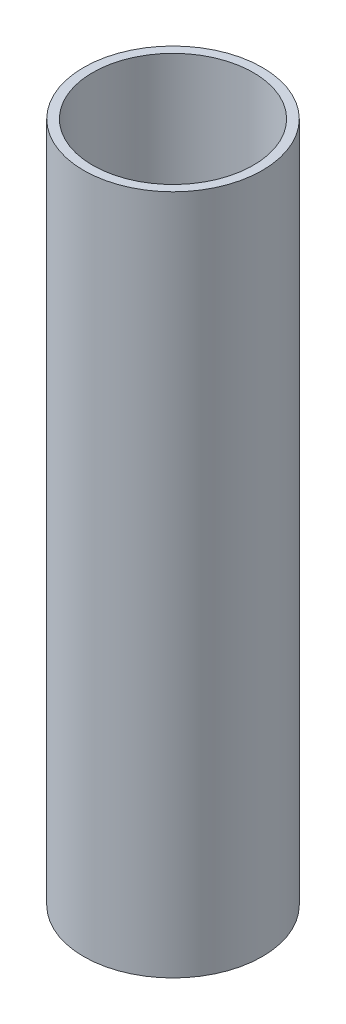
from build123d import *

# Parameters (mm, degrees)
SKETCH1_R           = 20
SKETCH1_R_2         = 18
BOSS_EXTRUDE1_DEPTH = 152.5


with BuildPart() as part:
    # Sketch1 → Boss-Extrude1 (new body)
    with BuildSketch(Plane(origin=(0, 0, 0), x_dir=(1, 0, 0), z_dir=(0, 1, 0))):
        with Locations(Location((0, 0, 0), (0, 0, 270))):
            Circle(SKETCH1_R)
        with Locations(Location((0, 0, 0), (0, 0, 270))):
            Circle(SKETCH1_R_2, mode=Mode.SUBTRACT)
    extrude(amount=BOSS_EXTRUDE1_DEPTH)


solid = part.part
